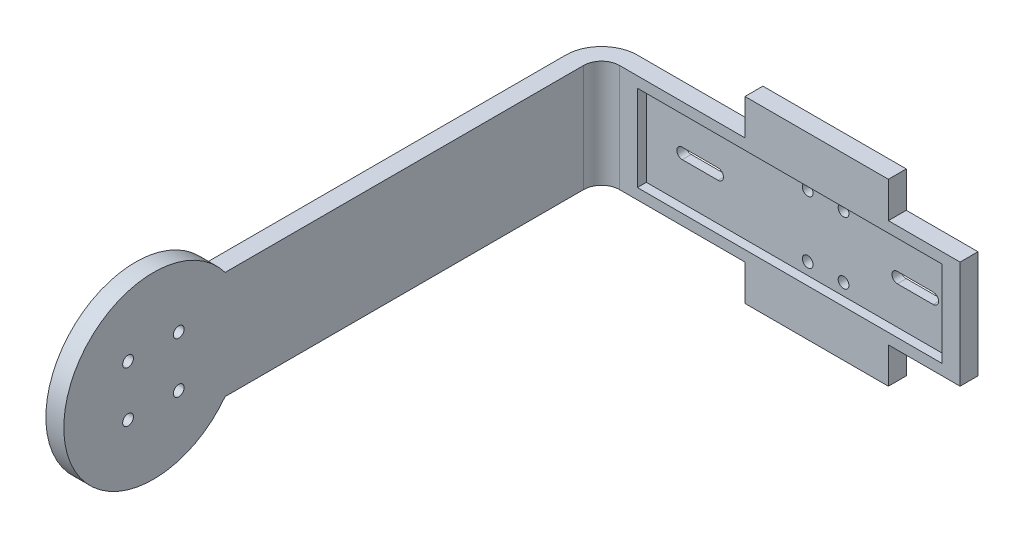
from build123d import *

# Parameters (mm, degrees)
BOSS_EXTRUDE1_DEPTH = 30
SKETCH4_R           = 25
BOSS_EXTRUDE3_DEPTH = 5
SKETCH8_W           = 85
SKETCH8_H           = 24
CUT_EXTRUDE2_DEPTH  = 2.5
SKETCH11_R          = 1.5
CUT_EXTRUDE4_DEPTH  = 5
SKETCH12_W          = 40
SKETCH12_H          = 10
BOSS_EXTRUDE5_DEPTH = 5
CUT_EXTRUDE5_DEPTH  = 2.5
SKETCH14_R          = 1.5
CUT_EXTRUDE6_DEPTH  = 189.745860882


with BuildPart() as part:
    # Sketch1 → Boss-Extrude1 (new body)
    with BuildSketch(Plane(origin=(0, 0, 0), x_dir=(1, 0, 0), z_dir=(0, 1, 0))):
        with BuildLine():
            Line((0, -5), (0, -125))
            Line((0, -125), (-5, -125))
            Line((-5, -125), (-5, -5))
            ThreePointArc((-5, -5), (-2.071067812, 2.071067812), (5, 5))
            Line((5, 5), (100, 5))
            Line((100, 5), (100, 0))
            Line((100, 0), (5, 0))
            ThreePointArc((5, 0), (1.464466094, -1.464466094), (0, -5))
        make_face()
    extrude(amount=-BOSS_EXTRUDE1_DEPTH)

    # Sketch4 → Boss-Extrude3 (add)
    with BuildSketch(Plane(origin=(0, 0, 0), x_dir=(0, 0, -1), z_dir=(1, 0, 0))):
        with Locations((-125, -15)):
            Circle(SKETCH4_R)
    extrude(amount=-BOSS_EXTRUDE3_DEPTH)

    # Sketch8 → Cut-Extrude2 (cut)
    with BuildSketch(Plane.XY):
        with Locations((52.5, -15)):
            Rectangle(SKETCH8_W, SKETCH8_H)
    extrude(amount=-CUT_EXTRUDE2_DEPTH, mode=Mode.SUBTRACT)

    # Sketch11 → Cut-Extrude4 (cut)
    with BuildSketch(Plane.ZY.offset(5)):
        with Locations((132.071067812, -7.928932188)):
            Circle(SKETCH11_R)
        with Locations((132.071067812, -22.071067812)):
            Circle(SKETCH11_R)
        with Locations((117.928932188, -22.071067812)):
            Circle(SKETCH11_R)
        with Locations((117.928932188, -7.928932188)):
            Circle(SKETCH11_R)
    extrude(amount=-CUT_EXTRUDE4_DEPTH, mode=Mode.SUBTRACT)

    # Sketch12 → Boss-Extrude5 (add)
    with BuildSketch(Plane(origin=(0, 0, -5), x_dir=(-1, 0, 0), z_dir=(0, 0, -1))):
        with Locations((-60, 5)):
            Rectangle(SKETCH12_W, SKETCH12_H)
        with Locations((-60, -35)):
            Rectangle(SKETCH12_W, SKETCH12_H)
    extrude(amount=-BOSS_EXTRUDE5_DEPTH)

    # Sketch13 → Cut-Extrude5 (cut)
    with BuildSketch(Plane.XY.offset(-2.5)):
        with BuildLine():
            Line((90, -16.5), (80, -16.5))
            ThreePointArc((80, -16.5), (78.5, -15), (80, -13.5))
            Line((80, -13.5), (90, -13.5))
            ThreePointArc((90, -13.5), (91.5, -15), (90, -16.5))
        make_face()
        with BuildLine():
            Line((20, -16.5), (30, -16.5))
            ThreePointArc((30, -16.5), (31.5, -15), (30, -13.5))
            Line((30, -13.5), (20, -13.5))
            ThreePointArc((20, -13.5), (18.5, -15), (20, -16.5))
        make_face()
    extrude(amount=-CUT_EXTRUDE5_DEPTH, mode=Mode.SUBTRACT)

    # Sketch14 → Cut-Extrude6 (cut, through all)
    with BuildSketch(Plane(origin=(0, 0, -5), x_dir=(-1, 0, 0), z_dir=(0, 0, -1))):
        with Locations((-65, -6.339745962)):
            Circle(SKETCH14_R)
        with Locations((-55, -6.339745962)):
            Circle(SKETCH14_R)
        with Locations((-55, -23.660254038)):
            Circle(SKETCH14_R)
        with Locations((-65, -23.660254038)):
            Circle(SKETCH14_R)
    extrude(amount=-CUT_EXTRUDE6_DEPTH, mode=Mode.SUBTRACT)


solid = part.part
